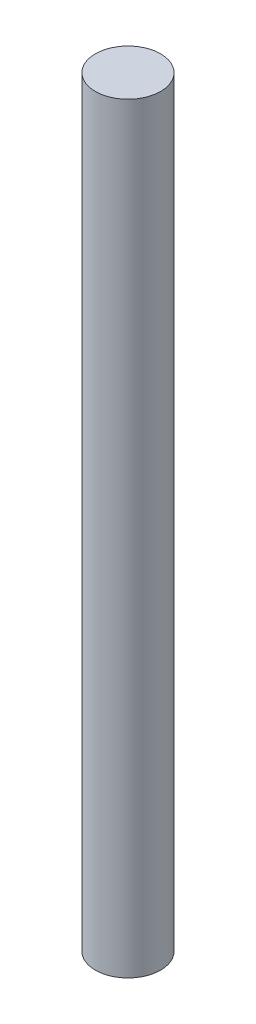
from build123d import *

# Parameters (mm, degrees)
SKETCH1_R           = 9
BOSS_EXTRUDE1_DEPTH = 210


with BuildPart() as part:
    # Sketch1 → Boss-Extrude1 (new body)
    with BuildSketch(Plane(origin=(0, 0, 0), x_dir=(1, 0, 0), z_dir=(0, 1, 0))):
        with Locations(Location((0, 0, 0), (0, 0, 270))):
            Circle(SKETCH1_R)
    extrude(amount=BOSS_EXTRUDE1_DEPTH)


solid = part.part
